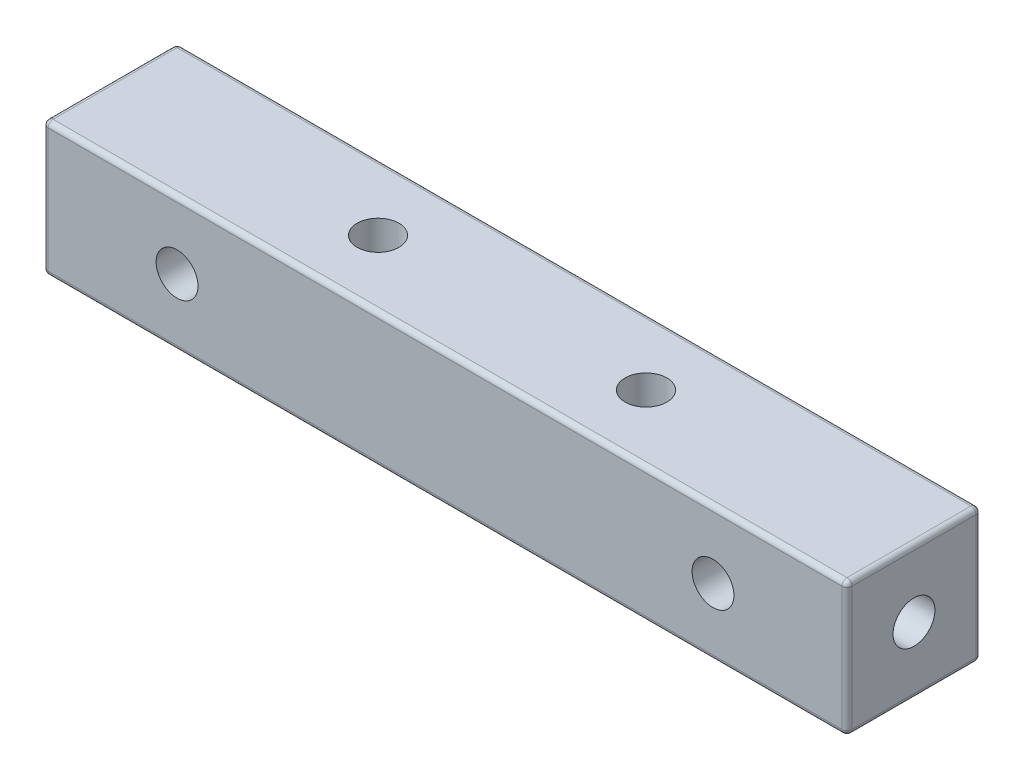
from build123d import *

# Parameters (mm, degrees)
SKETCH_1_W           = 8
SKETCH_1_H           = 8
EXTRUDE_1_DEPTH      = 24
FILLET_1_R           = 0.3
HOLE_WIZARD_1_D      = 2.5
HOLE_WIZARD_2_D      = 2.5
HOLE_WIZARD_3_REACH  = 50.332
HOLE_WIZARD_3_BORE_R = 1.25


with BuildPart() as part:
    # 草图1 → 凸台-拉伸1 (new, symmetric)
    with BuildSketch(Plane(origin=(0, 0, 0), x_dir=(0, 0, -1), z_dir=(1, 0, 0))):
        Rectangle(SKETCH_1_W, SKETCH_1_H)
    extrude(amount=EXTRUDE_1_DEPTH, both=True)

    # 圆角1
    fillet_1_edges = [part.edges().sort_by_distance(p)[0] for p in [
        (24, 0, 4),
        (24, -4, 0),
        (24, 0, -4),
        (-24, -4, 0),
        (-24, 0, 4),
        (-24, 4, 0),
        (-24, 0, -4),
        (0, -4, -4),
        (0, -4, 4),
        (0, 4, 4),
        (0, 4, -4),
        (24, 4, 0),
    ]]
    fillet(fillet_1_edges, radius=FILLET_1_R)

    # 螺纹孔1 (through all)
    with Locations(Plane(origin=(0, 4, 0), x_dir=(1, 0, 0), z_dir=(0, 1, 0))):
        with Locations((-8, 0), (8, 0)):
            Hole(HOLE_WIZARD_1_D / 2)

    # 螺纹孔2 (through all)
    with Locations(Plane.XY.offset(4)):
        with Locations((-16, 0), (16, 0)):
            Hole(HOLE_WIZARD_2_D / 2)

    # 螺纹孔3 bore → 螺纹孔3 (cut, up to next)
    with BuildSketch(Plane.ZY.offset(24), mode=Mode.PRIVATE) as hole_wizard_3_sk1:
        Circle(HOLE_WIZARD_3_BORE_R)
    hole_wizard_3_tool1 = extrude(hole_wizard_3_sk1.sketch, amount=-HOLE_WIZARD_3_REACH, mode=Mode.PRIVATE) & part.part
    hole_wizard_3 = hole_wizard_3_tool1.solids().sort_by_distance((-24, 0, 0))[0]
    add(hole_wizard_3, mode=Mode.SUBTRACT)

    # 镜向1: 螺纹孔3 across plane
    add(hole_wizard_3.mirror(Plane(origin=(0, 0, 0), x_dir=(0, 0, 1), z_dir=(1, 0, 0))), mode=Mode.SUBTRACT)


solid = part.part
